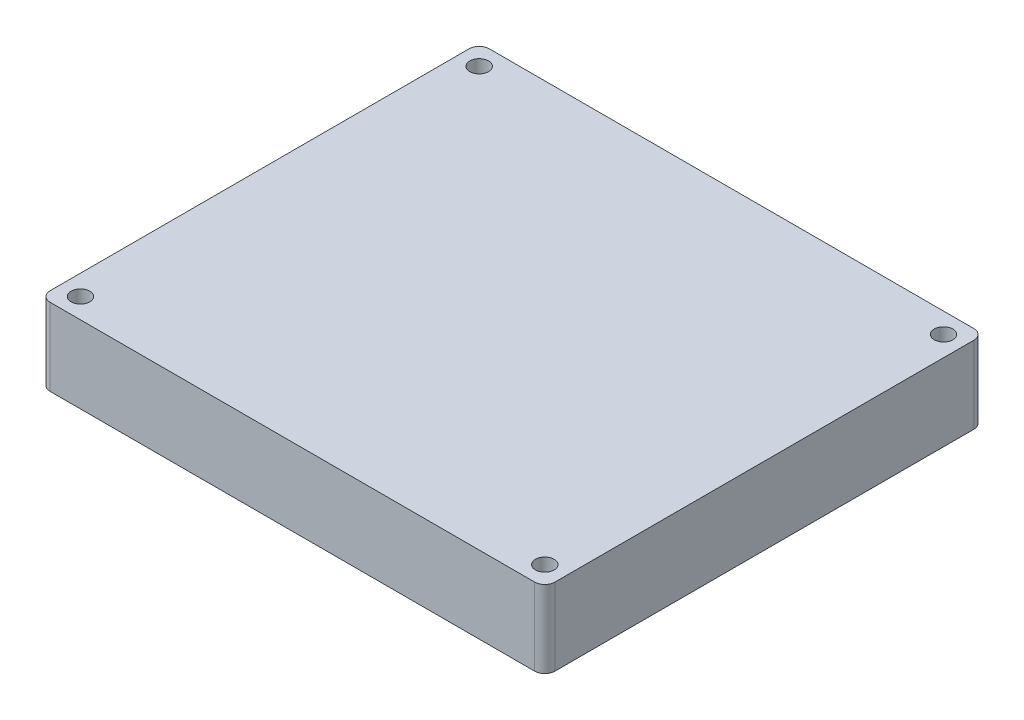
from build123d import *

# Parameters (mm, degrees)
SKETCH1_R           = 1.85
BOSS_EXTRUDE1_DEPTH = 15.29


with BuildPart() as part:
    # Sketch1 → Boss-Extrude1 (new body)
    with BuildSketch(Plane(origin=(0, 0, 0), x_dir=(1, 0, 0), z_dir=(0, 1, 0))):
        with BuildLine():
            Line((-48, -43.5), (48, -43.5))
            ThreePointArc((48, -43.5), (49.414213562, -42.914213562), (50, -41.5))
            Line((50, -41.5), (50, 41.5))
            ThreePointArc((50, 41.5), (49.414213562, 42.914213562), (48, 43.5))
            Line((48, 43.5), (-48, 43.5))
            ThreePointArc((-48, 43.5), (-49.414213562, 42.914213562), (-50, 41.5))
            Line((-50, 41.5), (-50, -41.5))
            ThreePointArc((-50, -41.5), (-49.414213562, -42.914213562), (-48, -43.5))
        make_face()
        with Locations(Location((46, 39.5, 0), (0, 0, 270))):
            Circle(SKETCH1_R, mode=Mode.SUBTRACT)
        with Locations(Location((46, -39.5, 0), (0, 0, 270))):
            Circle(SKETCH1_R, mode=Mode.SUBTRACT)
        with Locations(Location((-46, -39.5, 0), (0, 0, 270))):
            Circle(SKETCH1_R, mode=Mode.SUBTRACT)
        with Locations(Location((-46, 39.5, 0), (0, 0, 270))):
            Circle(SKETCH1_R, mode=Mode.SUBTRACT)
    extrude(amount=BOSS_EXTRUDE1_DEPTH)


solid = part.part
